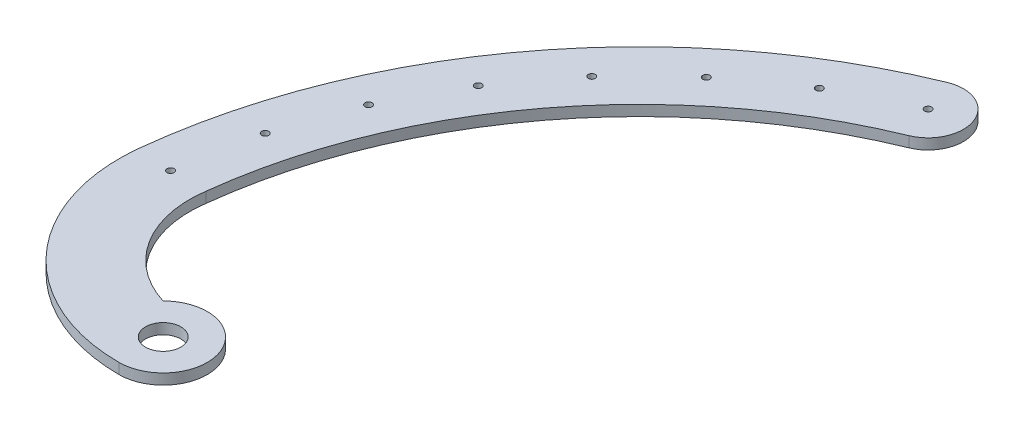
from build123d import *

# Parameters (mm, degrees)
IZIM1_R                     = 1
IZIM1_R_2                   = 12.5
IZIM1_R_3                   = 5
IZIM1_R_4                   = 10
Y_KSEKLIK_EKSTR_ZYON1_DEPTH = 3


with BuildPart() as part:
    # Çizim1 → Yükseklik-Ekstrüzyon1 (new body)
    # profile 1 of 3: a face of its own
    with BuildSketch(Plane(origin=(0, 0, 0), x_dir=(1, 0, 0), z_dir=(0, 1, 0))):
        with BuildLine():
            ThreePointArc((0, -12.5), (-11.543595981, -4.795351063), (-8.856895242, 8.820737309))
            ThreePointArc((-8.856895242, 8.820737309), (-25.386606646, 21.485478314), (-29.697678368, 41.85805018))
            ThreePointArc((-29.697678368, 41.85805018), (-2.160717, 110.170160276), (56.238508843, 155.051771745))
            ThreePointArc((56.238508843, 155.051771745), (43.192574473, 160.511038766), (48.651841494, 173.556973137))
            ThreePointArc((48.651841494, 173.556973137), (-18.46803273, 121.763907855), (-49.702354676, 42.947562724))
            ThreePointArc((-49.702354676, 42.947562724), (-37.231560108, 4.126193926), (0, -12.5))
        make_face()
        with Locations(Location((-39.761883741, 41.85805018, 0), (0, 0, 270))):
            Circle(IZIM1_R, mode=Mode.SUBTRACT)
        with Locations(Location((-35.520748055, 64.423751915, 0), (0, 0, 270))):
            Circle(IZIM1_R, mode=Mode.SUBTRACT)
        with Locations(Location((-27.885254768, 86.077790082, 0), (0, 0, 270))):
            Circle(IZIM1_R, mode=Mode.SUBTRACT)
        with Locations(Location((-17.034311334, 106.31278831, 0), (0, 0, 270))):
            Circle(IZIM1_R, mode=Mode.SUBTRACT)
        with Locations(Location((-3.222166513, 124.654619792, 0), (0, 0, 270))):
            Circle(IZIM1_R, mode=Mode.SUBTRACT)
        with Locations(Location((13.227546947, 140.673516564, 0), (0, 0, 270))):
            Circle(IZIM1_R, mode=Mode.SUBTRACT)
        with Locations(Location((31.929395352, 153.994139408, 0), (0, 0, 270))):
            Circle(IZIM1_R, mode=Mode.SUBTRACT)
    # profile 2 of 3: a face of its own
    with BuildSketch(Plane(origin=(0, 0, 0), x_dir=(1, 0, 0), z_dir=(0, 1, 0))):
        Circle(IZIM1_R_2)
        with Locations(Location((0, 0, 0), (0, 0, 270))):
            Circle(IZIM1_R_3, mode=Mode.SUBTRACT)
    # profile 3 of 3: a face of its own
    with BuildSketch(Plane(origin=(0, 0, 0), x_dir=(1, 0, 0), z_dir=(0, 1, 0))):
        with Locations((52.445175169, 164.304372441)):
            Circle(IZIM1_R_4)
        with Locations(Location((52.445175169, 164.304372441, 0), (0, 0, 270))):
            Circle(IZIM1_R, mode=Mode.SUBTRACT)
    extrude(amount=Y_KSEKLIK_EKSTR_ZYON1_DEPTH)


solid = part.part
